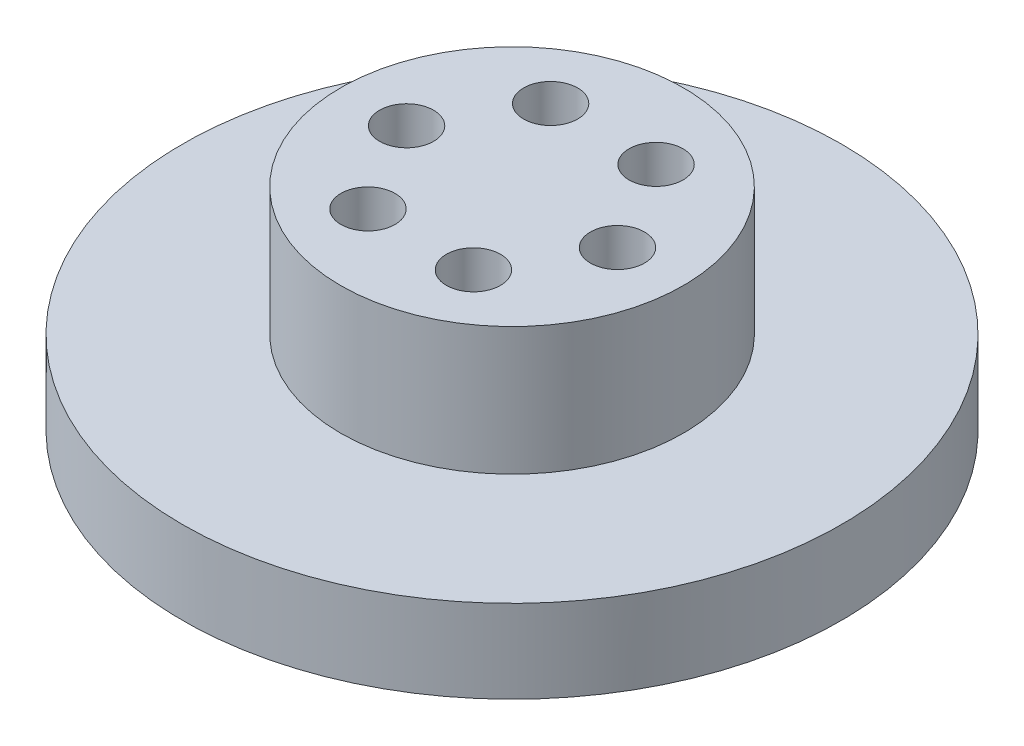
from build123d import *

# Parameters (mm, degrees)
SKETCH1_R           = 25
BOSS_EXTRUDE1_DEPTH = 8
SKETCH2_R           = 2.05
CUT_EXTRUDE3_DEPTH  = 7
CIRPATTERN2_COUNT   = 6
SKETCH3_W           = 12
SKETCH3_H           = 2
SKETCH4_R           = 25
CUT_EXTRUDE4_DEPTH  = 0.2
BOSS_EXTRUDE2_START = 2.2
SKETCH5_R           = 13
SKETCH5_R_2         = 2.05
BOSS_EXTRUDE2_DEPTH = 2.2
SKETCH6_R           = 3.5
CUT_EXTRUDE5_DEPTH  = 9
BOSS_EXTRUDE4_START = 3
SKETCH8_R           = 13
SKETCH8_R_2         = 2.05
BOSS_EXTRUDE4_DEPTH = 3
SKETCH9_R           = 3.6
CUT_EXTRUDE6_DEPTH  = 4
CIRPATTERN3_COUNT   = 8
BOSS_EXTRUDE6_START = 0.5
SKETCH11_R          = 25
SKETCH11_R_2        = 3.6
SKETCH11_R_3        = 3.5
BOSS_EXTRUDE6_DEPTH = 0.5
BOSS_EXTRUDE7_START = 2.5
SKETCH12_R          = 13
SKETCH12_R_2        = 2.05
BOSS_EXTRUDE7_DEPTH = 2.5


with BuildPart() as part:
    # Sketch1 → Boss-Extrude1 (new body)
    with BuildSketch(Plane(origin=(0, 0, 0), x_dir=(1, 0, 0), z_dir=(0, 1, 0))):
        with Locations(Location((0, 0, 0), (0, 0, 270))):
            Circle(SKETCH1_R)
    extrude(amount=BOSS_EXTRUDE1_DEPTH)

    # Sketch2 → Cut-Extrude3 (cut)
    with BuildSketch(Plane(origin=(0, 8, 0), x_dir=(1, 0, 0), z_dir=(0, 1, 0))):
        with Locations(Location((8, 0, 0), (0, 0, 270))):
            Circle(SKETCH2_R)
    cut_extrude3 = extrude(amount=-CUT_EXTRUDE3_DEPTH, mode=Mode.SUBTRACT)

    # CirPattern2: Cut-Extrude3 ×6 about axis
    cirpattern2_axis = Axis((0, 0, 0), (0, 1, 0))
    for i in range(1, CIRPATTERN2_COUNT):
        add(cut_extrude3.rotate(cirpattern2_axis, i * 360 / CIRPATTERN2_COUNT), mode=Mode.SUBTRACT)

    # Sketch3 → Cut-Revolve1 (revolve, cut)
    with BuildSketch(Plane.XY, mode=Mode.PRIVATE) as cut_revolve1_sk:
        with Locations((19, 7)):
            Rectangle(SKETCH3_W, SKETCH3_H)
    revolve(cut_revolve1_sk.sketch.rotate(Axis((0, 10.5, 0), (0, -1, 0)), 90), axis=Axis((0, 10.5, 0), (0, -1, 0)), mode=Mode.SUBTRACT)

    # Sketch4 → Cut-Extrude4 (cut)
    with BuildSketch(Plane.XZ):
        with Locations(Location((0, 0, 0), (0, 0, 270))):
            Circle(SKETCH4_R)
    extrude(amount=-CUT_EXTRUDE4_DEPTH, mode=Mode.SUBTRACT)

    # Sketch5 → Boss-Extrude2 (add)
    with BuildSketch(Plane(origin=(0, 8, 0), x_dir=(1, 0, 0), z_dir=(0, 1, 0)).offset(BOSS_EXTRUDE2_START)):
        with Locations(Location((0, 0, 0), (0, 0, 270))):
            Circle(SKETCH5_R)
        with Locations(Location((4, 6.92820323, 0), (0, 0, 270))):
            Circle(SKETCH5_R_2, mode=Mode.SUBTRACT)
        with Locations(Location((8, 0, 0), (0, 0, 270))):
            Circle(SKETCH5_R_2, mode=Mode.SUBTRACT)
        with Locations(Location((4, -6.92820323, 0), (0, 0, 270))):
            Circle(SKETCH5_R_2, mode=Mode.SUBTRACT)
        with Locations(Location((-4, -6.92820323, 0), (0, 0, 270))):
            Circle(SKETCH5_R_2, mode=Mode.SUBTRACT)
        with Locations(Location((-8, 0, 0), (0, 0, 270))):
            Circle(SKETCH5_R_2, mode=Mode.SUBTRACT)
        with Locations(Location((-4, 6.92820323, 0), (0, 0, 270))):
            Circle(SKETCH5_R_2, mode=Mode.SUBTRACT)
    extrude(amount=-BOSS_EXTRUDE2_DEPTH)

    # Sketch6 → Cut-Extrude5 (cut)
    with BuildSketch(Plane.XZ.offset(-0.2)):
        with Locations(Location((0, 0, 0), (0, 0, 270))):
            Circle(SKETCH6_R)
    extrude(amount=-CUT_EXTRUDE5_DEPTH, mode=Mode.SUBTRACT)

    # Sketch8 → Boss-Extrude4 (add)
    with BuildSketch(Plane(origin=(0, 10.2, 0), x_dir=(1, 0, 0), z_dir=(0, 1, 0)).offset(BOSS_EXTRUDE4_START)):
        with Locations(Location((0, 0, 0), (0, 0, 270))):
            Circle(SKETCH8_R)
        with Locations(Location((4, -6.92820323, 0), (0, 0, 270))):
            Circle(SKETCH8_R_2, mode=Mode.SUBTRACT)
        with Locations(Location((-4, -6.92820323, 0), (0, 0, 270))):
            Circle(SKETCH8_R_2, mode=Mode.SUBTRACT)
        with Locations(Location((-4, 6.92820323, 0), (0, 0, 270))):
            Circle(SKETCH8_R_2, mode=Mode.SUBTRACT)
        with Locations(Location((8, 0, 0), (0, 0, 270))):
            Circle(SKETCH8_R_2, mode=Mode.SUBTRACT)
        with Locations(Location((4, 6.92820323, 0), (0, 0, 270))):
            Circle(SKETCH8_R_2, mode=Mode.SUBTRACT)
        with Locations(Location((-8, 0, 0), (0, 0, 270))):
            Circle(SKETCH8_R_2, mode=Mode.SUBTRACT)
    extrude(amount=-BOSS_EXTRUDE4_DEPTH)

    # Sketch9 → Cut-Extrude6 (cut)
    with BuildSketch(Plane.XZ.offset(-0.2)):
        with Locations(Location((16, 0, 0), (0, 0, 270))):
            Circle(SKETCH9_R)
    cut_extrude6 = extrude(amount=-CUT_EXTRUDE6_DEPTH, mode=Mode.SUBTRACT)

    # CirPattern3: Cut-Extrude6 ×8 about axis
    cirpattern3_axis = Axis((0, 0, 0), (0, 1, 0))
    for i in range(1, CIRPATTERN3_COUNT):
        add(cut_extrude6.rotate(cirpattern3_axis, i * 360 / CIRPATTERN3_COUNT), mode=Mode.SUBTRACT)

    # Sketch11 → Boss-Extrude6 (add)
    with BuildSketch(Plane.XZ.offset(-0.2).offset(BOSS_EXTRUDE6_START)):
        with Locations(Location((0, 0, 0), (0, 0, 270))):
            Circle(SKETCH11_R)
        with Locations(Location((-16, 0, 0), (0, 0, 270))):
            Circle(SKETCH11_R_2, mode=Mode.SUBTRACT)
        with Locations(Location((-11.313708499, -11.313708499, 0), (0, 0, 270))):
            Circle(SKETCH11_R_2, mode=Mode.SUBTRACT)
        with Locations(Location((0, -16, 0), (0, 0, 270))):
            Circle(SKETCH11_R_2, mode=Mode.SUBTRACT)
        with Locations(Location((11.313708499, -11.313708499, 0), (0, 0, 270))):
            Circle(SKETCH11_R_2, mode=Mode.SUBTRACT)
        with Locations(Location((0, 0, 0), (0, 0, 270))):
            Circle(SKETCH11_R_3, mode=Mode.SUBTRACT)
        with Locations(Location((16, 0, 0), (0, 0, 270))):
            Circle(SKETCH11_R_2, mode=Mode.SUBTRACT)
        with Locations(Location((11.313708499, 11.313708499, 0), (0, 0, 270))):
            Circle(SKETCH11_R_2, mode=Mode.SUBTRACT)
        with Locations(Location((0, 16, 0), (0, 0, 270))):
            Circle(SKETCH11_R_2, mode=Mode.SUBTRACT)
        with Locations(Location((-11.313708499, 11.313708499, 0), (0, 0, 270))):
            Circle(SKETCH11_R_2, mode=Mode.SUBTRACT)
    extrude(amount=-BOSS_EXTRUDE6_DEPTH)

    # Sketch12 → Boss-Extrude7 (add)
    with BuildSketch(Plane(origin=(0, 13.2, 0), x_dir=(1, 0, 0), z_dir=(0, 1, 0)).offset(BOSS_EXTRUDE7_START)):
        with Locations(Location((0, 0, 0), (0, 0, 270))):
            Circle(SKETCH12_R)
        with Locations(Location((4, 6.92820323, 0), (0, 0, 270))):
            Circle(SKETCH12_R_2, mode=Mode.SUBTRACT)
        with Locations(Location((8, 0, 0), (0, 0, 270))):
            Circle(SKETCH12_R_2, mode=Mode.SUBTRACT)
        with Locations(Location((4, -6.92820323, 0), (0, 0, 270))):
            Circle(SKETCH12_R_2, mode=Mode.SUBTRACT)
        with Locations(Location((-4, -6.92820323, 0), (0, 0, 270))):
            Circle(SKETCH12_R_2, mode=Mode.SUBTRACT)
        with Locations(Location((-8, 0, 0), (0, 0, 270))):
            Circle(SKETCH12_R_2, mode=Mode.SUBTRACT)
        with Locations(Location((-4, 6.92820323, 0), (0, 0, 270))):
            Circle(SKETCH12_R_2, mode=Mode.SUBTRACT)
    extrude(amount=-BOSS_EXTRUDE7_DEPTH)


solid = part.part
